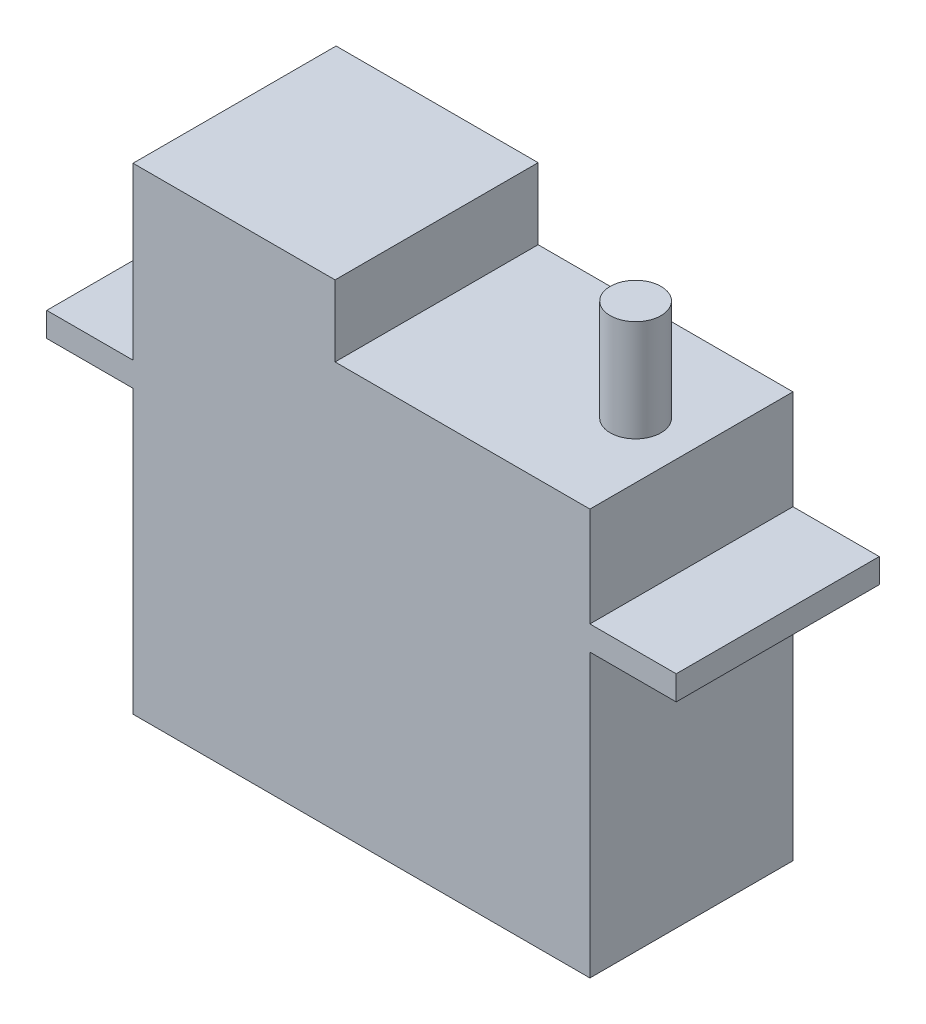
from build123d import *

# Parameters (mm, degrees)
BOSS_EXTRU_1_DEPTH      = 5
BOSS_EXTRU_1_DEPTH_BACK = 5
ESQUISSE3_R             = 1.25
BOSS_EXTRU_2_DEPTH      = 5


with BuildPart() as part:
    # Esquisse1 → Boss.-Extru.1 (new, two sides: drawn at the far end of the back side and taken through both)
    with BuildSketch(Plane.XY.offset(-BOSS_EXTRU_1_DEPTH_BACK)):
        Polygon((0, 0), (22.5, 0), (22.5, 13.9), (26.75, 13.9), (26.75, 15.1), (22.5, 15.1), (22.5, 20), (9.95, 20), (9.95, 23.5), (0, 23.5), (0, 15.1), (-4.25, 15.1), (-4.25, 13.9), (0, 13.9), align=None)
    extrude(amount=BOSS_EXTRU_1_DEPTH + BOSS_EXTRU_1_DEPTH_BACK)

    # Esquisse3 → Boss.-Extru.2 (add)
    with BuildSketch(Plane(origin=(0, 20, 0), x_dir=(1, 0, 0), z_dir=(0, 1, 0))):
        with Locations((19.75, 0)):
            Circle(ESQUISSE3_R)
    extrude(amount=BOSS_EXTRU_2_DEPTH)


solid = part.part
